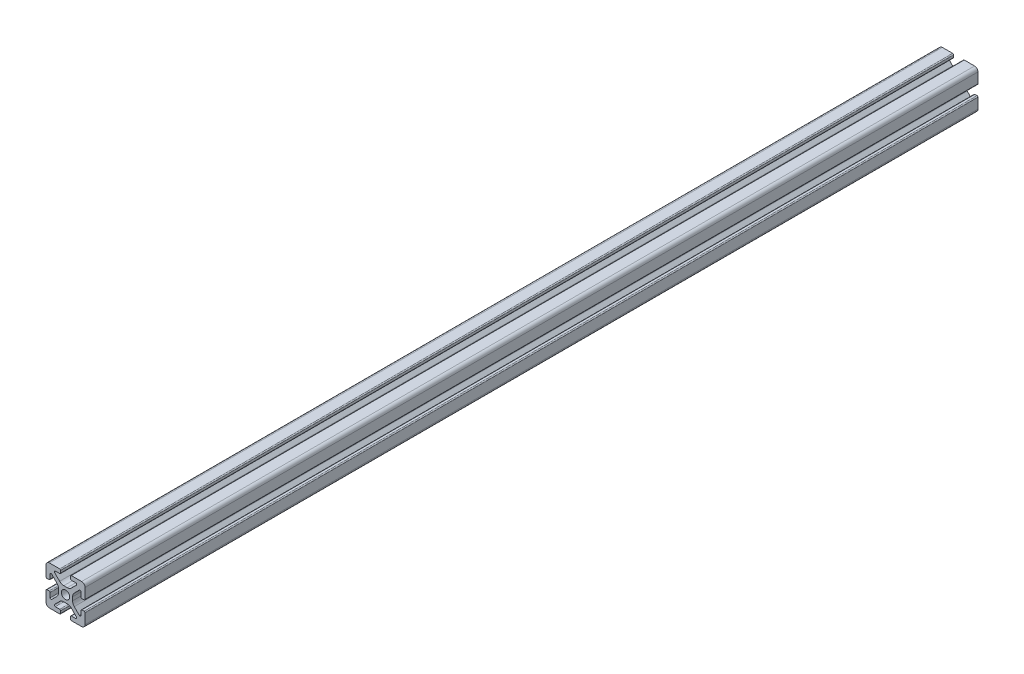
from build123d import *

# Parameters (mm, degrees)
BOSS_EXTRUDE1_DEPTH = 228.6


with BuildPart() as part:
    # Sketch4 → Boss-Extrude1 (new, symmetric)
    with BuildSketch(Plane.XY):
        with BuildLine():
            Line((3, -10), (8.25, -10))
            ThreePointArc((8.25, -10), (9.487436867, -9.487436867), (10, -8.25))
            Line((10, -8.25), (10, -3))
            ThreePointArc((10, -3), (9.853553391, -2.646446609), (9.5, -2.5))
            Line((9.5, -2.5), (8.424621202, -2.5))
            ThreePointArc((8.424621202, -2.5), (8.071067812, -2.646446609), (7.924621202, -3))
            Line((7.924621202, -3), (7.924621202, -5.25))
            ThreePointArc((7.924621202, -5.25), (7.615962919, -5.711939766), (7.071067812, -5.603553391))
            Line((7.071067812, -5.603553391), (4.478679656, -3.011165235))
            ThreePointArc((4.478679656, -3.011165235), (3.828361402, -2.037895189), (3.6, -0.889844892))
            Line((3.6, -0.889844892), (3.6, 0))
            Line((3.6, 0), (2.15, 0))
            ThreePointArc((2.15, 0), (1.52027958, -1.52027958), (0, -2.15))
            Line((0, -2.15), (0, -3.6))
            Line((0, -3.6), (0.889844892, -3.6))
            ThreePointArc((0.889844892, -3.6), (2.037895189, -3.828361402), (3.011165235, -4.478679656))
            Line((3.011165235, -4.478679656), (5.603553391, -7.071067812))
            ThreePointArc((5.603553391, -7.071067812), (5.711939766, -7.615962919), (5.25, -7.924621202))
            Line((5.25, -7.924621202), (3, -7.924621202))
            ThreePointArc((3, -7.924621202), (2.646446609, -8.071067812), (2.5, -8.424621202))
            Line((2.5, -8.424621202), (2.5, -9.5))
            ThreePointArc((2.5, -9.5), (2.646446609, -9.853553391), (3, -10))
        make_face()
    extrude(amount=BOSS_EXTRUDE1_DEPTH, both=True)

    # Mirror1: part across plane


with BuildPart() as part_1:
    add(part.part)
    add(part.part.mirror(Plane(origin=(0, 0, 0), x_dir=(0, 0, 1), z_dir=(1, 0, 0))))

    # Mirror2: part across plane


with BuildPart() as part_2:
    add(part_1.part)
    add(part_1.part.mirror(Plane.ZX))


solid = part_2.part
